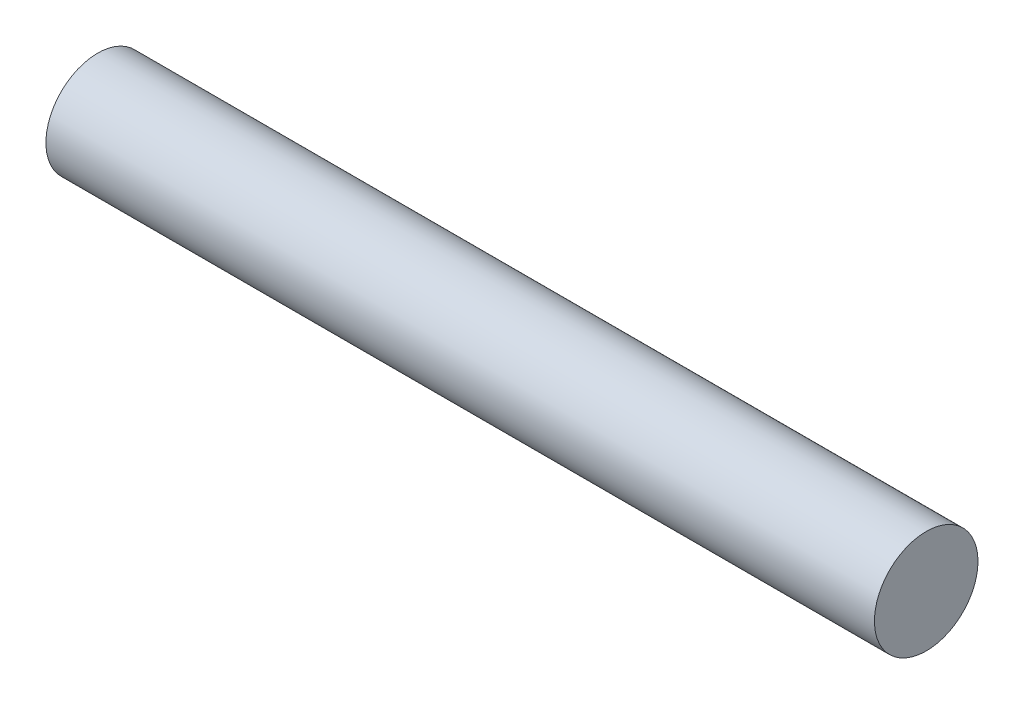
from build123d import *

# Parameters (mm, degrees)
SKETCH1_R           = 0.375
BOSS_EXTRUDE1_DEPTH = 6


with BuildPart() as part:
    # Sketch1 → Boss-Extrude1 (new body)
    with BuildSketch(Plane(origin=(0, 0, 0), x_dir=(0, 0, -1), z_dir=(1, 0, 0))):
        Circle(SKETCH1_R)
    extrude(amount=BOSS_EXTRUDE1_DEPTH)


solid = part.part
